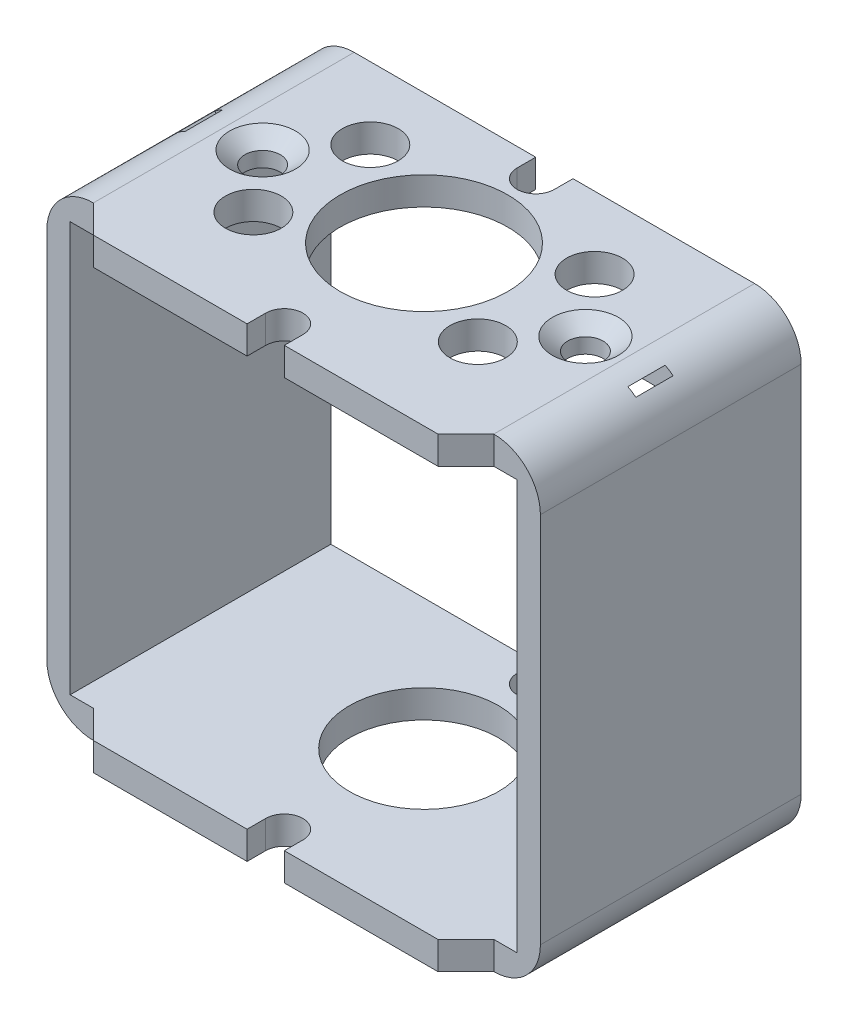
from build123d import *

# Parameters (mm, degrees)
SKETCH1_W                                         = 53
SKETCH1_H                                         = 50
BOSS_EXTRUDE1_DEPTH                               = 28
FILLET1_R                                         = 5
SKETCH2_W                                         = 48
SKETCH2_H                                         = 44
CUT_EXTRUDE1_DEPTH                                = 28
SKETCH3_W                                         = 43
SKETCH3_H                                         = 3
BOSS_EXTRUDE2_DEPTH                               = 3
CUT_EXTRUDE2_DEPTH                                = 3
SKETCH10_R                                        = 8
CUT_EXTRUDE3_DEPTH                                = 3
CUT_EXTRUDE4_DEPTH                                = 3
CUT_EXTRUDE5_DEPTH                                = 3
MIRROR2_COPY_1_DEPTH                              = 3
SKETCH13_R                                        = 9
CUT_EXTRUDE12_DEPTH                               = 3
SKETCH14_R                                        = 3
CUT_EXTRUDE13_DEPTH                               = 3
SKETCH15_R                                        = 3
CUT_EXTRUDE14_DEPTH                               = 3
SKETCH39_W                                        = 4
SKETCH39_H                                        = 1
CUT_EXTRUDE15_DEPTH                               = 5
CSK_FOR_6_FLAT_HEAD_MACHINE_SCREW_100_D           = 3.7973
CSK_FOR_6_FLAT_HEAD_MACHINE_SCREW_100_DEPTH       = 3
CSK_FOR_6_FLAT_HEAD_MACHINE_SCREW_100_CSINK_D     = 7.0866
CSK_FOR_6_FLAT_HEAD_MACHINE_SCREW_100_CSINK_ANGLE = 100


with BuildPart() as part:
    # Sketch1 → Boss-Extrude1 (new body)
    with BuildSketch(Plane.XY):
        Rectangle(SKETCH1_W, SKETCH1_H)
    extrude(amount=BOSS_EXTRUDE1_DEPTH)

    # Fillet1
    fillet1_edges = [part.edges().sort_by_distance(p)[0] for p in [
        (26.5, -25, 14),
        (-26.5, -25, 14),
        (-26.5, 25, 14),
        (26.5, 25, 14),
    ]]
    fillet(fillet1_edges, radius=FILLET1_R)

    # Sketch2 → Cut-Extrude1 (cut)
    with BuildSketch(Plane.XY.offset(28)):
        Rectangle(SKETCH2_W, SKETCH2_H)
    extrude(amount=-CUT_EXTRUDE1_DEPTH, mode=Mode.SUBTRACT)

    # Sketch3 → Boss-Extrude2 (add)
    with BuildSketch(Plane.XY.offset(28)):
        with Locations((0, -23.5)):
            Rectangle(SKETCH3_W, SKETCH3_H)
    boss_extrude2 = extrude(amount=BOSS_EXTRUDE2_DEPTH)

    # Sketch9 → Cut-Extrude2 (cut)
    with BuildSketch(Plane.XZ.offset(25)):
        Polygon((21.5, 28), (18.5, 31), (21.5, 31), align=None)
    cut_extrude2 = extrude(amount=-CUT_EXTRUDE2_DEPTH, mode=Mode.SUBTRACT)

    # Mirror1: Cut-Extrude2 across plane
    add(cut_extrude2.mirror(Plane(origin=(0, 0, 0), x_dir=(0, 0, 1), z_dir=(1, 0, 0))), mode=Mode.SUBTRACT)

    # Sketch10 → Cut-Extrude3 (cut)
    with BuildSketch(Plane(origin=(0, -25, 0), x_dir=(-1, 0, 0), z_dir=(0, -1, 0))):
        with Locations(Location((0, -14, 0), (0, 0, 90))):
            Circle(SKETCH10_R)
    extrude(amount=-CUT_EXTRUDE3_DEPTH, mode=Mode.SUBTRACT)

    # Sketch11 → Cut-Extrude4 (cut)
    with BuildSketch(Plane.XZ.offset(25)):
        with BuildLine():
            Line((2, 31), (2, 29))
            ThreePointArc((2, 29), (0, 27), (-2, 29))
            Line((-2, 29), (-2, 31))
            ThreePointArc((-2, 31), (0, 33), (2, 31))
        make_face()
    cut_extrude4 = extrude(amount=-CUT_EXTRUDE4_DEPTH, mode=Mode.SUBTRACT)

    # Sketch12 → Cut-Extrude5 (cut)
    with BuildSketch(Plane.XZ.offset(25)):
        with BuildLine():
            Line((-2, 0), (-2, 2))
            ThreePointArc((-2, 2), (0, 4), (2, 2))
            Line((2, 2), (2, 0))
            ThreePointArc((2, 0), (0, -2), (-2, 0))
        make_face()
    cut_extrude5 = extrude(amount=-CUT_EXTRUDE5_DEPTH, mode=Mode.SUBTRACT)

    # Mirror2: Boss-Extrude2, Cut-Extrude2, Cut-Extrude4, Cut-Extrude5 across plane
    add(boss_extrude2.mirror(Plane.ZX))
    add(cut_extrude2.mirror(Plane.ZX), mode=Mode.SUBTRACT)
    add(cut_extrude4.mirror(Plane.ZX), mode=Mode.SUBTRACT)
    add(cut_extrude5.mirror(Plane.ZX), mode=Mode.SUBTRACT)

    # Mirror2 copy 1 sketch → Mirror2 copy 1 (cut)
    with BuildSketch(Plane(origin=(0, 25, 0), x_dir=(-1, 0, 0), z_dir=(0, 1, 0))):
        Polygon((21.5, 28), (18.5, 31), (21.5, 31), align=None)
    extrude(amount=-MIRROR2_COPY_1_DEPTH, mode=Mode.SUBTRACT)

    # Sketch13 → Cut-Extrude12 (cut)
    with BuildSketch(Plane(origin=(0, 25, 0), x_dir=(1, 0, 0), z_dir=(0, 1, 0))):
        with Locations(Location((0, -14, 0), (0, 0, 270))):
            Circle(SKETCH13_R)
    extrude(amount=-CUT_EXTRUDE12_DEPTH, mode=Mode.SUBTRACT)

    # Sketch14 → Cut-Extrude13 (cut)
    with BuildSketch(Plane(origin=(0, 25, 0), x_dir=(1, 0, 0), z_dir=(0, 1, 0))):
        with Locations(Location((-12.052516567, -20.270787808, 0), (0, 0, 270))):
            Circle(SKETCH14_R)
    cut_extrude13 = extrude(amount=-CUT_EXTRUDE13_DEPTH, mode=Mode.SUBTRACT)

    # Sketch15 → Cut-Extrude14 (cut)
    with BuildSketch(Plane(origin=(0, 25, 0), x_dir=(1, 0, 0), z_dir=(0, 1, 0))):
        with Locations(Location((-12.043222485, -7.723673845, 0), (0, 0, 270))):
            Circle(SKETCH15_R)
    cut_extrude14 = extrude(amount=-CUT_EXTRUDE14_DEPTH, mode=Mode.SUBTRACT)

    # Sketch39 → Cut-Extrude15 (cut)
    with BuildSketch(Plane(origin=(-24.285533906, 24.285533906, 0), x_dir=(0, 0, -1), z_dir=(-0.7071067811865464, 0.7071067811865488, 0))):
        with Locations((-13.86492965, 0)):
            Rectangle(SKETCH39_W, SKETCH39_H)
    cut_extrude15 = extrude(amount=-CUT_EXTRUDE15_DEPTH, mode=Mode.SUBTRACT)

    # CSK for #6 Flat Head Machine Screw (100)1
    with Locations(Plane(origin=(0, 25, 0), x_dir=(1, 0, 0), z_dir=(0, 1, 0))):
        with Locations((-17.332413571, -14)):
            csk_for_6_flat_head_machine_screw_100 = CounterSinkHole(CSK_FOR_6_FLAT_HEAD_MACHINE_SCREW_100_D / 2, CSK_FOR_6_FLAT_HEAD_MACHINE_SCREW_100_CSINK_D / 2, depth=CSK_FOR_6_FLAT_HEAD_MACHINE_SCREW_100_DEPTH, counter_sink_angle=CSK_FOR_6_FLAT_HEAD_MACHINE_SCREW_100_CSINK_ANGLE)

    # Mirror3: Cut-Extrude13, Cut-Extrude14, Cut-Extrude15, CSK for #6 Flat Head Machine Screw (100)1 across plane
    add(cut_extrude13.mirror(Plane(origin=(0, 0, 0), x_dir=(0, 0, 1), z_dir=(1, 0, 0))), mode=Mode.SUBTRACT)
    add(cut_extrude14.mirror(Plane(origin=(0, 0, 0), x_dir=(0, 0, 1), z_dir=(1, 0, 0))), mode=Mode.SUBTRACT)
    add(cut_extrude15.mirror(Plane(origin=(0, 0, 0), x_dir=(0, 0, 1), z_dir=(1, 0, 0))), mode=Mode.SUBTRACT)
    add(csk_for_6_flat_head_machine_screw_100.mirror(Plane(origin=(0, 0, 0), x_dir=(0, 0, 1), z_dir=(1, 0, 0))), mode=Mode.SUBTRACT)


solid = part.part
